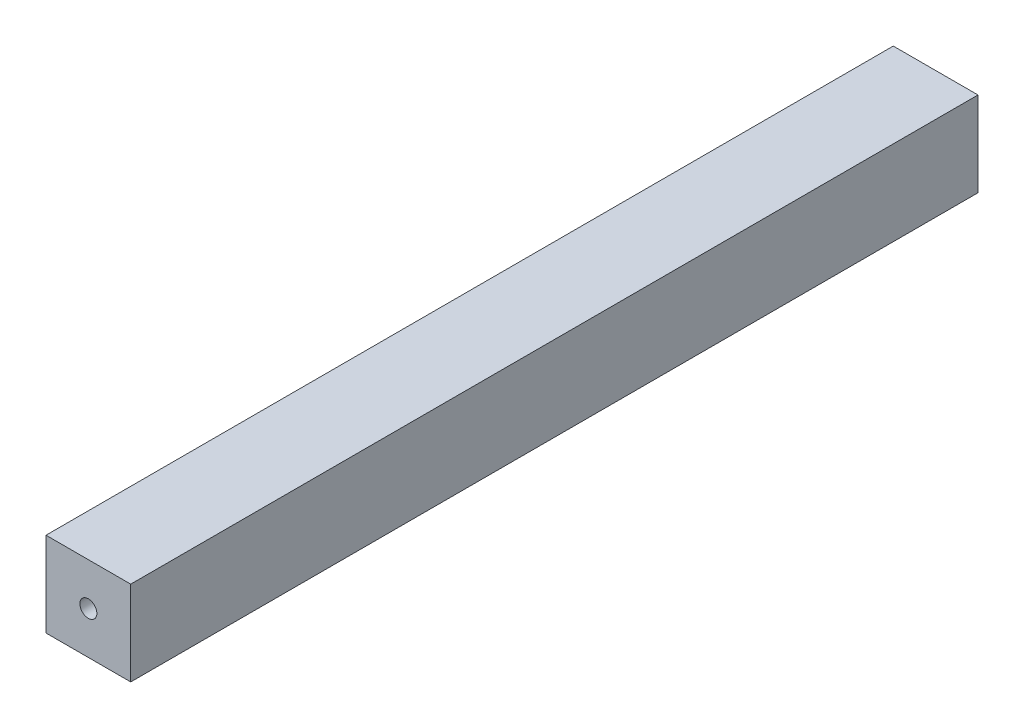
from build123d import *

# Parameters (mm, degrees)
ESQUISSE1_W             = 25
ESQUISSE1_H             = 25
BOSS_EXTRU_1_DEPTH      = 250
ESQUISSE2_R             = 2.5
ENL_V_MAT_EXTRU_3_DEPTH = 250


with BuildPart() as part:
    # Esquisse1 → Boss.-Extru.1 (new body)
    with BuildSketch(Plane.XY):
        Rectangle(ESQUISSE1_W, ESQUISSE1_H)
    extrude(amount=BOSS_EXTRU_1_DEPTH)

    # Esquisse2 → Enlèv. mat.-Extru.3 (cut)
    with BuildSketch(Plane.XY):
        Circle(ESQUISSE2_R)
    extrude(amount=ENL_V_MAT_EXTRU_3_DEPTH, mode=Mode.SUBTRACT)


solid = part.part
